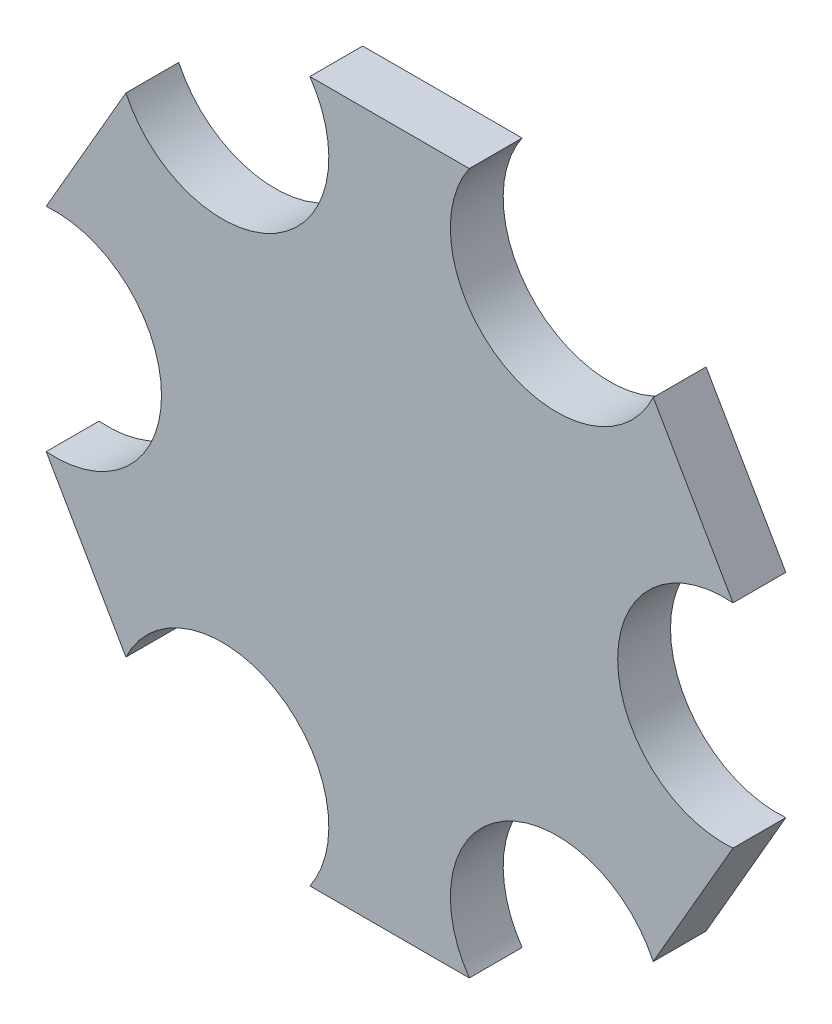
from build123d import *

# Parameters (mm, degrees)
EXTRUDE_1_DEPTH     = 1.5
SKETCH_2_R          = 3.025074469
CUT_EXTRUDE_1_DEPTH = 16.272715323


with BuildPart() as part:
    # 草图1 → 凸台-拉伸1 (new body)
    with BuildSketch(Plane.XY):
        Polygon((11.489270357, 0), (5.744635178, 9.95), (-5.744635178, 9.95), (-11.489270357, 0), (-5.744635178, -9.95), (5.744635178, -9.95), align=None)
    extrude(amount=EXTRUDE_1_DEPTH)

    # 草图2 → 切除-拉伸1 (cut, through all)
    with BuildSketch(Plane.XY.offset(1.5)):
        with Locations((-9.5, 0)):
            Circle(SKETCH_2_R)
        with Locations((-4.75, 8.227241336)):
            Circle(SKETCH_2_R)
        with Locations((4.75, 8.227241336)):
            Circle(SKETCH_2_R)
        with Locations((9.5, 0)):
            Circle(SKETCH_2_R)
        with Locations((4.75, -8.227241336)):
            Circle(SKETCH_2_R)
        with Locations((-4.75, -8.227241336)):
            Circle(SKETCH_2_R)
    extrude(amount=-CUT_EXTRUDE_1_DEPTH, mode=Mode.SUBTRACT)

    # 草图4 → 旋转-薄壁2 (revolve)
    with BuildSketch(Plane(origin=(0, 0, 0), x_dir=(0, 0, -1), z_dir=(1, 0, 0)), mode=Mode.PRIVATE) as revolve_2_sk:
        with BuildLine():
            Line((0, 0), (3.62, 0))
            ThreePointArc((3.62, 0), (2.559726548, 2.559726548), (0, 3.62))
            Line((0, 3.62), (0, 3.52))
            ThreePointArc((0, 3.52), (2.453405796, 2.52412361), (3.518579259, 0.1))
            Line((3.518579259, 0.1), (0, 0.1))
            Line((0, 0.1), (0, 0))
        make_face()
    revolve(revolve_2_sk.sketch.rotate(Axis((0, 0, 0), (0, 0, -1)), 90), axis=Axis((0, 0, 0), (0, 0, -1)))


solid = part.part
